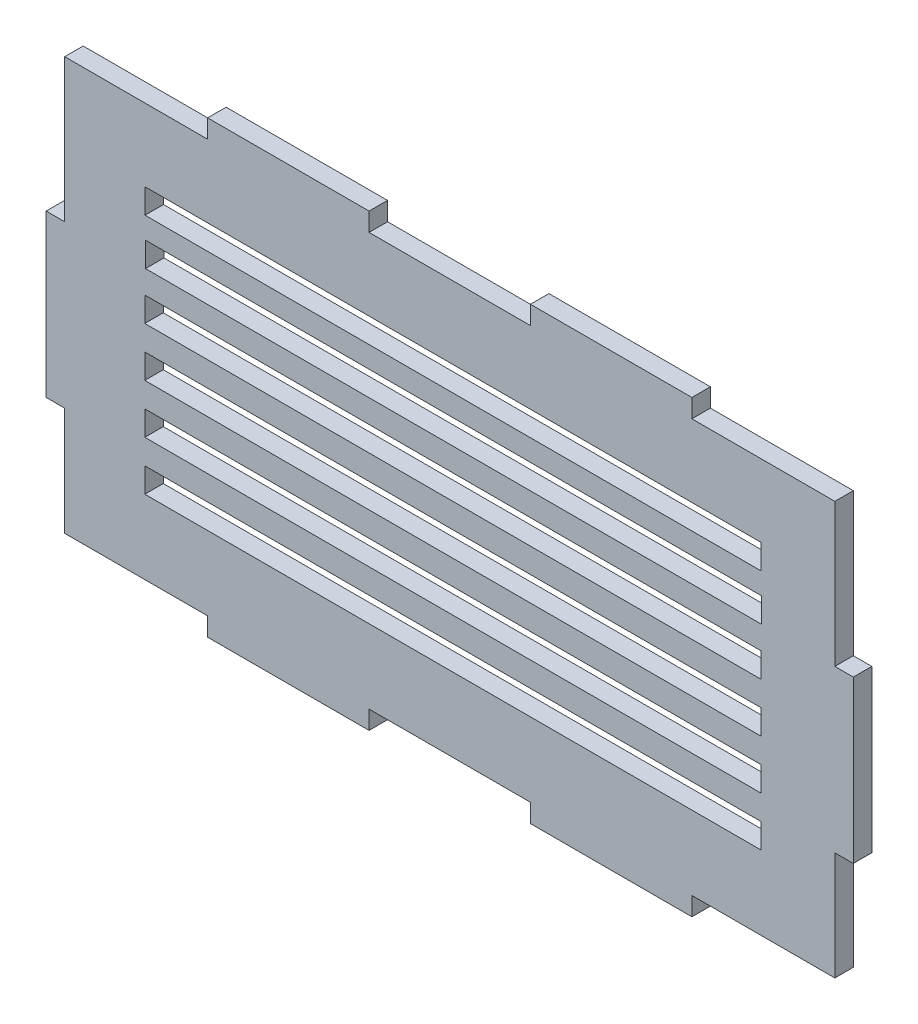
from build123d import *

# Parameters (mm, degrees)
SKETCH1_W           = 100
SKETCH1_H           = 4
BOSS_EXTRUDE1_DEPTH = 3


with BuildPart() as part:
    # Sketch1 → Boss-Extrude1 (new body)
    with BuildSketch(Plane.XY):
        Polygon((104.8, 73), (78.6, 73), (78.6, 70), (52.4, 70), (52.4, 73), (26.2, 73), (26.2, 70), (3, 70), (3, 46.8), (0, 46.8), (0, 20.6), (3, 20.6), (3, 3), (26.2, 3), (26.2, 0), (52.4, 0), (52.4, 3), (78.6, 3), (78.6, 0), (104.8, 0), (104.8, 3), (128, 3), (128, 20.6), (131, 20.6), (131, 46.8), (128, 46.8), (128, 70), (104.8, 70), align=None)
        with Locations((66, 17)):
            Rectangle(SKETCH1_W, SKETCH1_H, mode=Mode.SUBTRACT)
        with Locations((66, 25)):
            Rectangle(SKETCH1_W, SKETCH1_H, mode=Mode.SUBTRACT)
        with Locations((66, 33)):
            Rectangle(SKETCH1_W, SKETCH1_H, mode=Mode.SUBTRACT)
        with Locations((66, 41)):
            Rectangle(SKETCH1_W, SKETCH1_H, mode=Mode.SUBTRACT)
        with Locations((66.113104448, 48.769073691)):
            Rectangle(SKETCH1_W, SKETCH1_H, mode=Mode.SUBTRACT)
        with Locations((66.03984148, 56.236196533)):
            Rectangle(SKETCH1_W, SKETCH1_H, mode=Mode.SUBTRACT)
    extrude(amount=BOSS_EXTRUDE1_DEPTH)


solid = part.part
